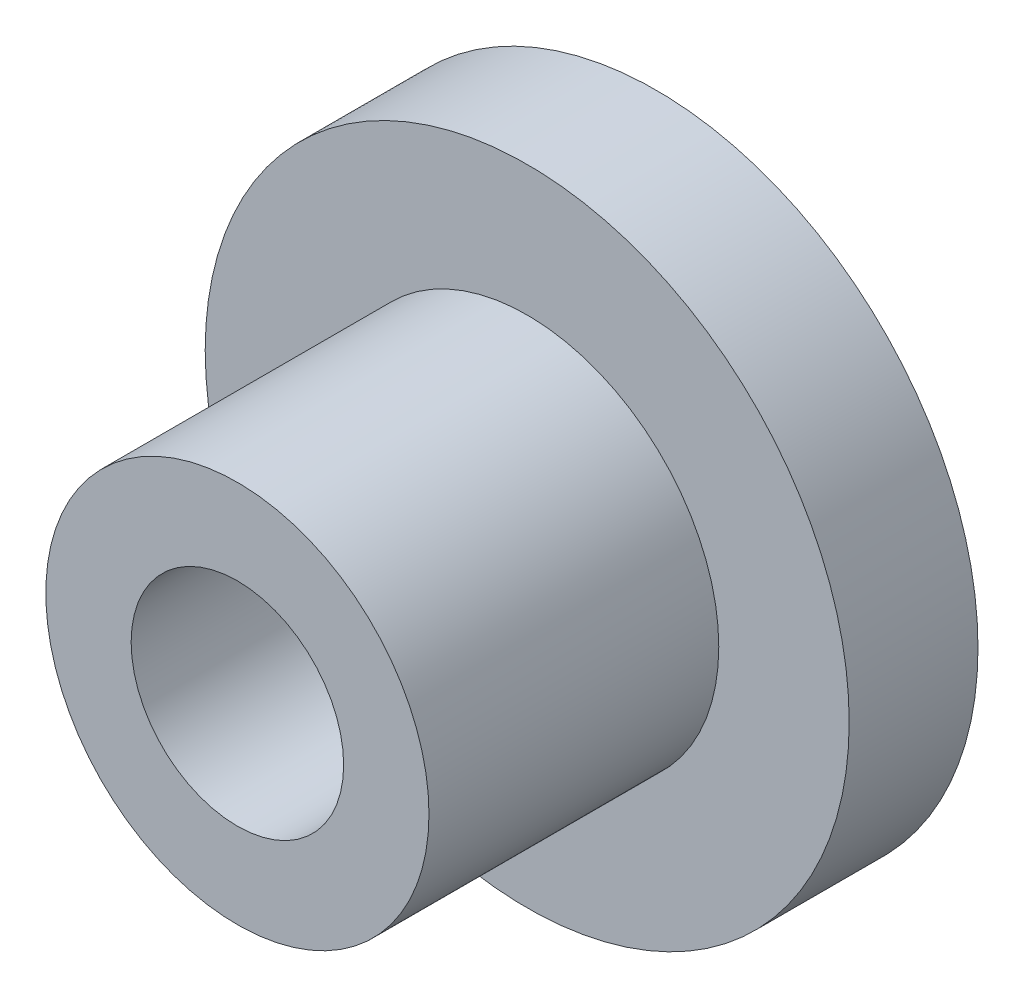
from build123d import *


with BuildPart() as part:
    # Esquisse1 → Révolution1 (revolve)
    with BuildSketch(Plane(origin=(0, 0, 0), x_dir=(1, 0, 0), z_dir=(0, 1, 0))):
        Polygon((5, -2), (5, 0), (1.65, 0), (1.65, -6.5), (2.975, -6.5), (2.975, -2), align=None)
    revolve(axis=Axis((0, 0, 0), (0, 0, 1)))


solid = part.part
